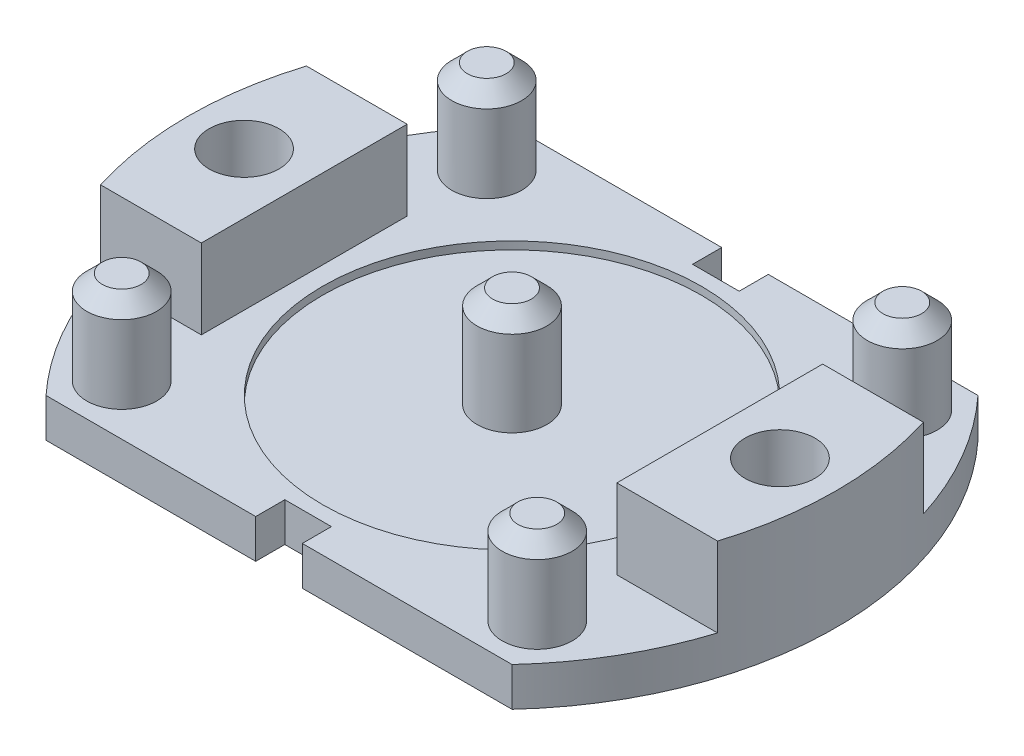
from build123d import *

# Parameters (mm, degrees)
SALIENTE_EXTRUIR1_DEPTH = 1
CROQUIS3_R              = 4.875
CORTAR_EXTRUIR1_DEPTH   = 0.2
CROQUIS4_R              = 0.9
CROQUIS4_R_2            = 0.8999999999999994
SALIENTE_EXTRUIR2_DEPTH = 3.4
CHAFL_N1_SIZE           = 0.4
CROQUIS5_R              = 0.8999999999999995
CROQUIS5_R_2            = 0.9000000000000004
CORTAR_EXTRUIR2_DEPTH   = 2.4
CORTAR_EXTRUIR3_START   = -0.35
CORTAR_EXTRUIR3_DEPTH   = 0.35


with BuildPart() as part:
    # Croquis1 → Saliente-Extruir1 (new body)
    with BuildSketch(Plane(origin=(0, 0, 0), x_dir=(1, 0, 0), z_dir=(0, 1, 0))):
        with BuildLine():
            Line((6.000000000184592, 6.000000000000001), (0.6000000001845911, 6.0000000000897735))
            Line((0.6000000001845911, 6.0000000000897735), (0.600000000184591, 5.250000000089774))
            Line((0.600000000184591, 5.250000000089774), (-0.5999999998154079, 5.250000000089775))
            Line((-0.5999999998154079, 5.250000000089775), (-0.5999999998154087, 6.000000000109725))
            Line((-0.5999999998154087, 6.000000000109725), (-5.999999999815408, 6.0000000001995))
            ThreePointArc((-5.999999999815408, 6.0000000001995), (-8.349999999490638, 1.358977e-10), (-6, -6.000000000000001))
            Line((-6, -6.000000000000001), (-0.6, -6.000000000089775))
            Line((-0.6, -6.000000000089775), (-0.6, -5.250000000109726))
            Line((-0.6, -5.250000000109726), (0.6, -5.250000000109726))
            Line((0.6, -5.250000000109726), (0.6000000000000001, -6.000000000109724))
            Line((0.6000000000000001, -6.000000000109724), (6.000000000000001, -6.000000000199499))
            ThreePointArc((6.000000000000001, -6.000000000199499), (8.349999999490638, -1.3589858e-10), (6.000000000184592, 6.000000000000001))
        make_face()
    extrude(amount=SALIENTE_EXTRUIR1_DEPTH)

    # Croquis3 → Cortar-Extruir1 (cut)
    with BuildSketch(Plane(origin=(0, 1, 0), x_dir=(1, 0, 0), z_dir=(0, 1, 0))):
        with Locations(Location((0, 0, 0), (0, 0, 270))):
            Circle(CROQUIS3_R)
    extrude(amount=-CORTAR_EXTRUIR1_DEPTH, mode=Mode.SUBTRACT)

    # Croquis4 → Saliente-Extruir2 (add)
    with BuildSketch(Plane.XZ):
        with Locations(Location((0, 0, 0), (0, 0, 270))):
            Circle(CROQUIS4_R)
        with Locations(Location((-5.3500000000000005, 4.700000000000001, 0), (0, 0, 270))):
            Circle(CROQUIS4_R_2)
        with Locations(Location((-5.349999999815407, -4.700000000199502, 0), (0, 0, 270))):
            Circle(CROQUIS4_R_2)
        with Locations(Location((5.3500000000000005, 4.700000000000001, 0), (0, 0, 270))):
            Circle(CROQUIS4_R_2)
        with Locations(Location((5.3500000000000005, -4.700000000199502, 0), (0, 0, 270))):
            Circle(CROQUIS4_R_2)
        with BuildLine():
            Line((5.3500000000000005, 2.65), (5.3500000000000005, -2.65))
            Line((5.3500000000000005, -2.65), (7.9431895310497564, -2.65))
            ThreePointArc((7.9431895310497564, -2.65), (8.349999999490638, 0), (7.9431895310497564, 2.65))
            Line((7.9431895310497564, 2.65), (5.3500000000000005, 2.65))
        make_face()
        with BuildLine():
            Line((-5.349999999999999, -2.65), (-5.349999999999999, 2.65))
            Line((-5.349999999999999, 2.65), (-7.94318953102517, 2.65))
            ThreePointArc((-7.94318953102517, 2.65), (-8.349999999490638, 1.08e-15), (-7.94318953102517, -2.65))
            Line((-7.94318953102517, -2.65), (-5.349999999999999, -2.65))
        make_face()
    extrude(amount=-SALIENTE_EXTRUIR2_DEPTH)

    # Chaflán1
    chafl_n1_edges = [part.edges().sort_by_distance(p)[0] for p in [
        (2.8e-16, 3.4, 0.9),
        (-5.3500000000000005, 3.4, 5.6000000000000005),
        (5.3500000000000005, 3.4, 5.6000000000000005),
        (-5.349999999815407, 3.4, -3.8000000001995025),
        (5.3500000000000005, 3.4, -3.8000000001995025),
    ]]
    chamfer(chafl_n1_edges, length=CHAFL_N1_SIZE)

    # Croquis5 → Cortar-Extruir2 (cut)
    with BuildSketch(Plane(origin=(0, 3.4, 0), x_dir=(1, 0, 0), z_dir=(0, 1, 0))):
        with Locations(Location((-6.899999999999999, 0, 0), (0, 0, 270))):
            Circle(CROQUIS5_R)
        with Locations(Location((6.8999999999999995, 0, 0), (0, 0, 270))):
            Circle(CROQUIS5_R_2)
    extrude(amount=-CORTAR_EXTRUIR2_DEPTH, mode=Mode.SUBTRACT)

    # Croquis6 → Cortar-Extruir3 (cut)
    with BuildSketch(Plane(origin=(0, 3.4, 0), x_dir=(1, 0, 0), z_dir=(0, 1, 0)).offset(CORTAR_EXTRUIR3_START)):
        with BuildLine():
            Line((-5.349999999999999, 2.65), (-7.943189531025168, 2.6499999999999995))
            ThreePointArc((-7.943189531025168, 2.6499999999999995), (-8.349999999490636, 1.08e-15), (-7.94318953102517, -2.65))
            Line((-7.94318953102517, -2.65), (-5.349999999999999, -2.65))
            Line((-5.349999999999999, -2.65), (-5.349999999999999, 2.65))
        make_face()
        with BuildLine():
            Line((5.3500000000000005, -2.65), (7.9431895310497564, -2.6499999999999995))
            ThreePointArc((7.9431895310497564, -2.6499999999999995), (8.349999999490638, 4.9e-16), (7.9431895310497564, 2.65))
            Line((7.9431895310497564, 2.65), (5.3500000000000005, 2.65))
            Line((5.3500000000000005, 2.65), (5.3500000000000005, -2.65))
        make_face()
    extrude(amount=CORTAR_EXTRUIR3_DEPTH, mode=Mode.SUBTRACT)


solid = part.part
